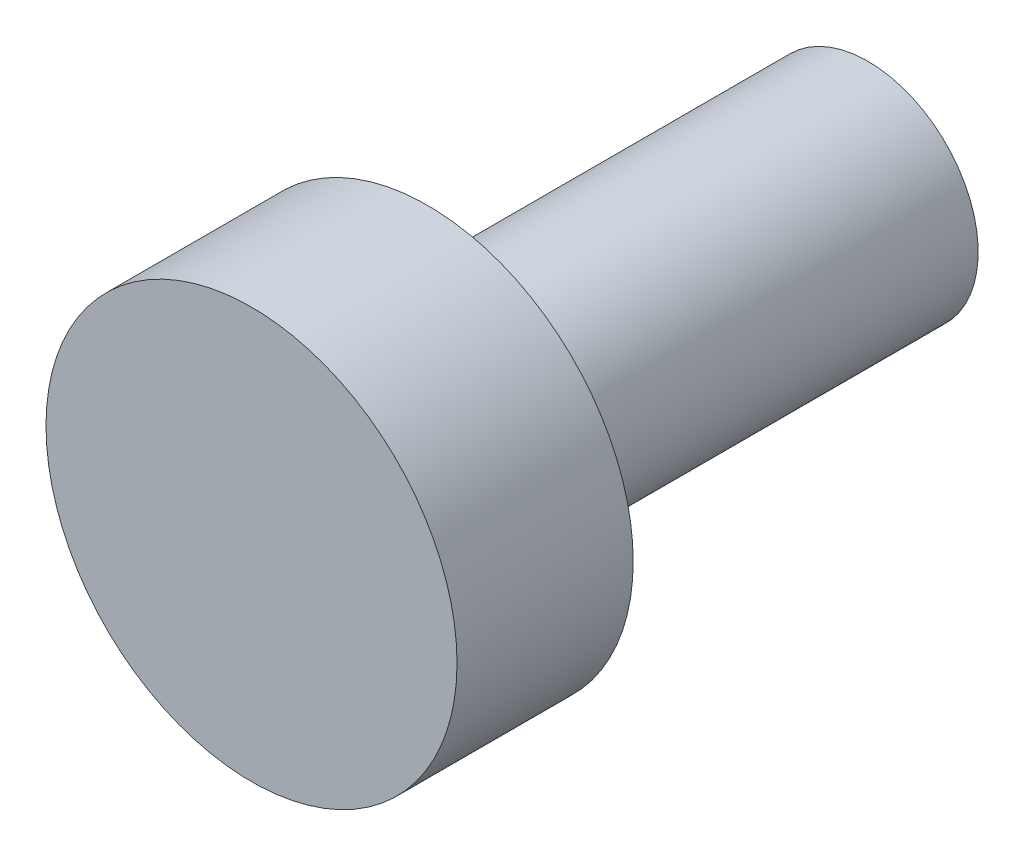
from build123d import *

# Parameters (mm, degrees)
ESQUISSE1_R        = 2.8
BOSS_EXTRU_1_DEPTH = 2.4
ESQUISSE2_R        = 1.5
BOSS_EXTRU_2_DEPTH = 6


with BuildPart() as part:
    # Esquisse1 → Boss.-Extru.1 (new body)
    with BuildSketch(Plane.XY):
        Circle(ESQUISSE1_R)
    extrude(amount=BOSS_EXTRU_1_DEPTH)

    # Esquisse2 → Boss.-Extru.2 (add)
    with BuildSketch(Plane(origin=(0, 0, 0), x_dir=(-1, 0, 0), z_dir=(0, 0, -1))):
        Circle(ESQUISSE2_R)
    extrude(amount=BOSS_EXTRU_2_DEPTH)


solid = part.part
